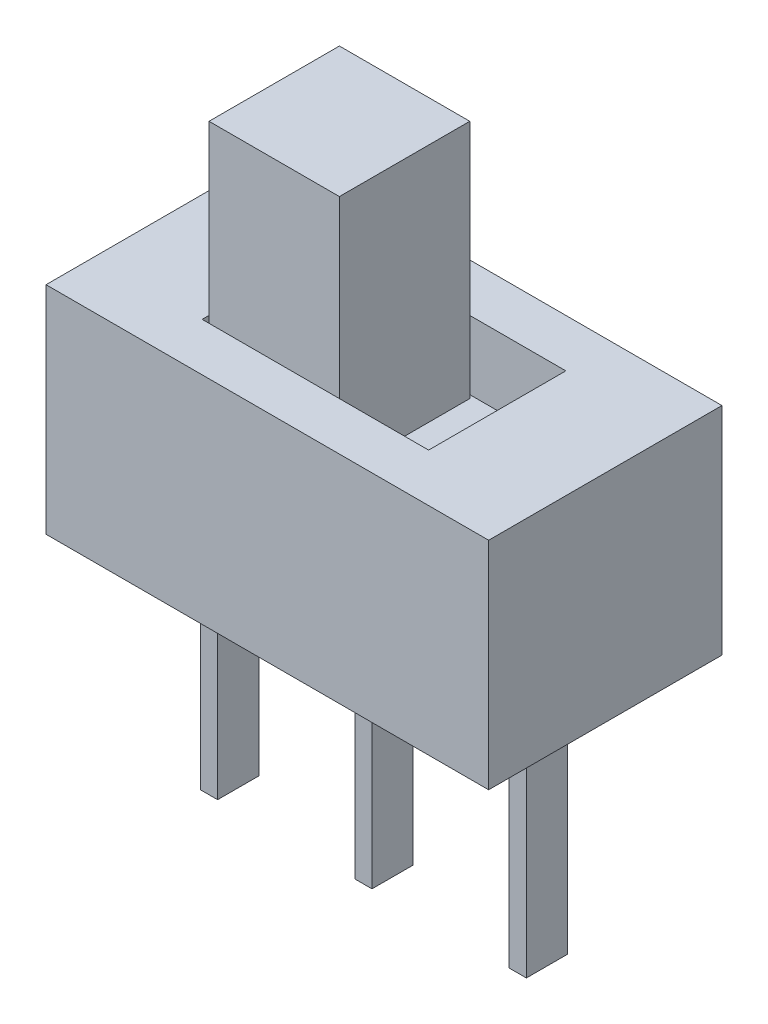
from build123d import *

# Parameters (mm, degrees)
SKETCH1_W           = 12.9
SKETCH1_H           = 6.8
BOSS_EXTRUDE1_DEPTH = 6.3
SKETCH2_W           = 6.6
SKETCH2_H           = 4
CUT_EXTRUDE1_DEPTH  = 2
SKETCH3_W           = 3.8
SKETCH3_H           = 3.8
BOSS_EXTRUDE3_DEPTH = 7
SKETCH4_W           = 0.5
SKETCH4_H           = 1.2
BOSS_EXTRUDE4_DEPTH = 7
LPATTERN1_COUNT     = 2
LPATTERN1_PITCH     = 4.5
LPATTERN1_COL_COUNT = 2
LPATTERN1_COL_PITCH = 4.5


with BuildPart() as part:
    # Sketch1 → Boss-Extrude1 (new body)
    with BuildSketch(Plane(origin=(0, 0, 0), x_dir=(1, 0, 0), z_dir=(0, 1, 0))):
        Rectangle(SKETCH1_W, SKETCH1_H)
    extrude(amount=BOSS_EXTRUDE1_DEPTH)

    # Sketch2 → Cut-Extrude1 (cut)
    with BuildSketch(Plane(origin=(0, 6.3, 0), x_dir=(1, 0, 0), z_dir=(0, 1, 0))):
        Rectangle(SKETCH2_W, SKETCH2_H)
    extrude(amount=-CUT_EXTRUDE1_DEPTH, mode=Mode.SUBTRACT)

    # Sketch3 → Boss-Extrude3 (add)
    with BuildSketch(Plane(origin=(0, 4.3, 0), x_dir=(1, 0, 0), z_dir=(0, 1, 0))):
        with Locations((-1.3, 0)):
            Rectangle(SKETCH3_W, SKETCH3_H)
    extrude(amount=BOSS_EXTRUDE3_DEPTH)

    # Sketch4 → Boss-Extrude4 (add)
    with BuildSketch(Plane.XZ):
        Rectangle(SKETCH4_W, SKETCH4_H)
    boss_extrude4 = extrude(amount=BOSS_EXTRUDE4_DEPTH)

    # LPattern1: Boss-Extrude4 ×2
    with Locations(*[(i * LPATTERN1_PITCH, 0, 0) for i in range(1, LPATTERN1_COUNT)]):
        add(boss_extrude4)

    # LPattern1 col: Boss-Extrude4 ×2
    with Locations(*[(-i * LPATTERN1_COL_PITCH, 0, 0) for i in range(1, LPATTERN1_COL_COUNT)]):
        add(boss_extrude4)


solid = part.part
